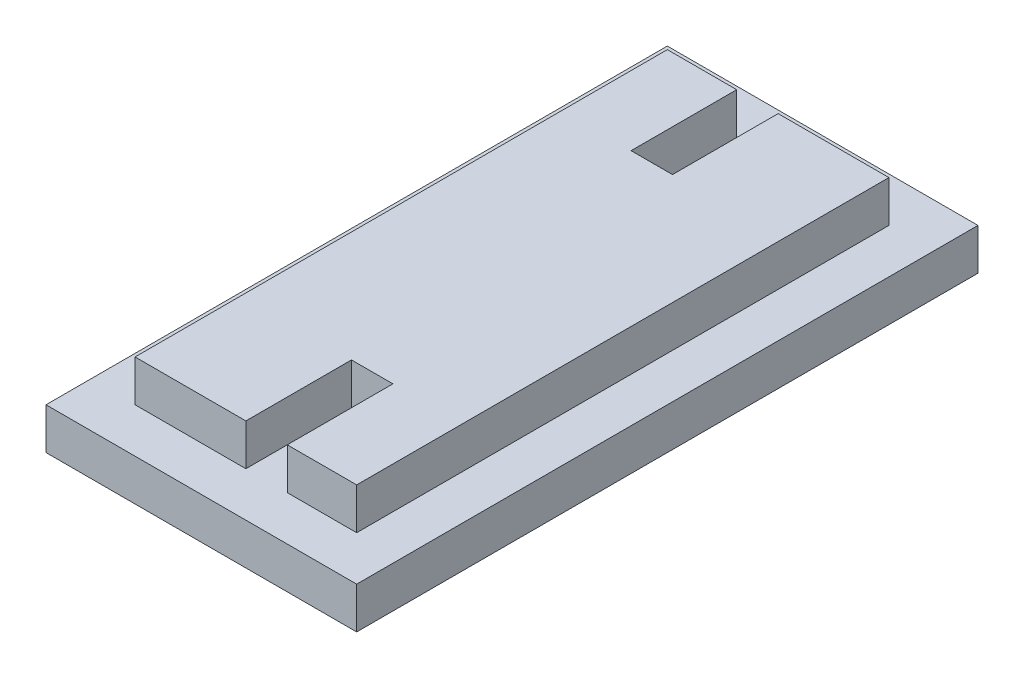
from build123d import *

# Parameters (mm, degrees)
SKETCH1_W           = 15
SKETCH1_H           = 30
BOSS_EXTRUDE1_DEPTH = 2
SKETCH2_W           = 10.7
SKETCH2_H           = 25.7
BOSS_EXTRUDE2_DEPTH = 2
SKETCH3_W           = 2
SKETCH3_H           = 5.1
CUT_EXTRUDE1_DEPTH  = 2


with BuildPart() as part:
    # Sketch1 → Boss-Extrude1 (new body)
    with BuildSketch(Plane(origin=(0, 0, 0), x_dir=(1, 0, 0), z_dir=(0, 1, 0))):
        with Locations((7.5, 15)):
            Rectangle(SKETCH1_W, SKETCH1_H)
    extrude(amount=BOSS_EXTRUDE1_DEPTH)

    # Sketch2 → Boss-Extrude2 (add)
    with BuildSketch(Plane(origin=(0, 2, 0), x_dir=(1, 0, 0), z_dir=(0, 1, 0))):
        with Locations((7.5, 15)):
            Rectangle(SKETCH2_W, SKETCH2_H)
    extrude(amount=BOSS_EXTRUDE2_DEPTH)

    # Sketch3 → Cut-Extrude1 (cut)
    with BuildSketch(Plane(origin=(0, 4, 0), x_dir=(1, 0, 0), z_dir=(0, 1, 0))):
        with Locations((6.5, 25.3)):
            Rectangle(SKETCH3_W, SKETCH3_H)
        with Locations((8.5, 4.7)):
            Rectangle(SKETCH3_W, SKETCH3_H)
    extrude(amount=-CUT_EXTRUDE1_DEPTH, mode=Mode.SUBTRACT)


solid = part.part
